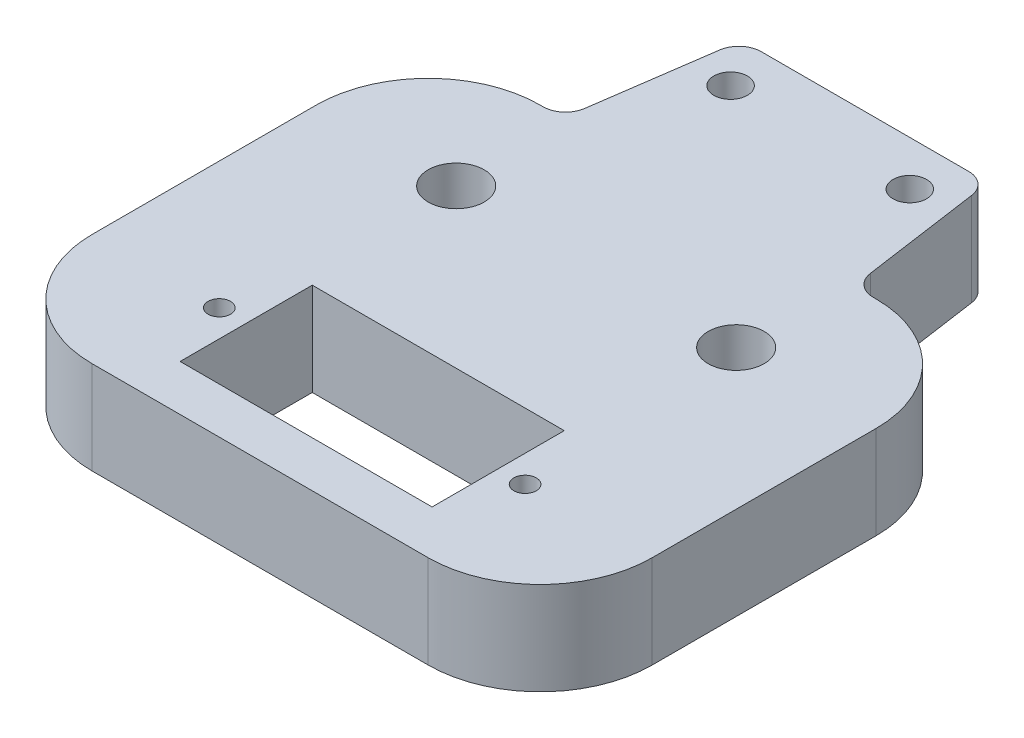
from build123d import *

# Parameters (mm, degrees)
SKETCH1_R           = 2.5
SKETCH1_R_2         = 1
SKETCH1_R_3         = 1.5
SKETCH1_W           = 22.5
SKETCH1_H           = 11.8
BOSS_EXTRUDE1_DEPTH = 8.3
FILLET1_R           = 2


with BuildPart() as part:
    # Sketch1 → Boss-Extrude1 (new body)
    with BuildSketch(Plane(origin=(0, 0, 0), x_dir=(1, 0, 0), z_dir=(0, 1, 0))):
        with BuildLine():
            Line((-15, 20), (-13, 20))
            Line((-13, 20), (-11, 34))
            Line((-11, 34), (11, 34))
            Line((11, 34), (13, 20))
            Line((13, 20), (15, 20))
            ThreePointArc((15, 20), (22.071067812, 17.071067812), (25, 10))
            Line((25, 10), (25, -10))
            ThreePointArc((25, -10), (22.071067812, -17.071067812), (15, -20))
            Line((15, -20), (-15, -20))
            ThreePointArc((-15, -20), (-22.071067812, -17.071067812), (-25, -10))
            Line((-25, -10), (-25, 10))
            ThreePointArc((-25, 10), (-22.071067812, 17.071067812), (-15, 20))
        make_face()
        with Locations(Location((-12.5, 10, 0), (0, 0, 90))):
            Circle(SKETCH1_R, mode=Mode.SUBTRACT)
        with Locations(Location((12.5, 10, 0), (0, 0, 90))):
            Circle(SKETCH1_R, mode=Mode.SUBTRACT)
        with Locations(Location((13.65, -10, 0), (0, 0, 90))):
            Circle(SKETCH1_R_2, mode=Mode.SUBTRACT)
        with Locations(Location((-13.65, -10, 0), (0, 0, 90))):
            Circle(SKETCH1_R_2, mode=Mode.SUBTRACT)
        with Locations(Location((8, 30, 0), (0, 0, 90))):
            Circle(SKETCH1_R_3, mode=Mode.SUBTRACT)
        with Locations(Location((-8, 30, 0), (0, 0, 90))):
            Circle(SKETCH1_R_3, mode=Mode.SUBTRACT)
        with Locations((0, -10)):
            Rectangle(SKETCH1_W, SKETCH1_H, mode=Mode.SUBTRACT)
    extrude(amount=BOSS_EXTRUDE1_DEPTH)

    # Fillet1
    fillet1_edges = [part.edges().sort_by_distance(p)[0] for p in [
        (-13, 4.15, -20),
        (-11, 4.15, -34),
        (11, 4.15, -34),
        (13, 4.15, -20),
    ]]
    fillet(fillet1_edges, radius=FILLET1_R)


solid = part.part
